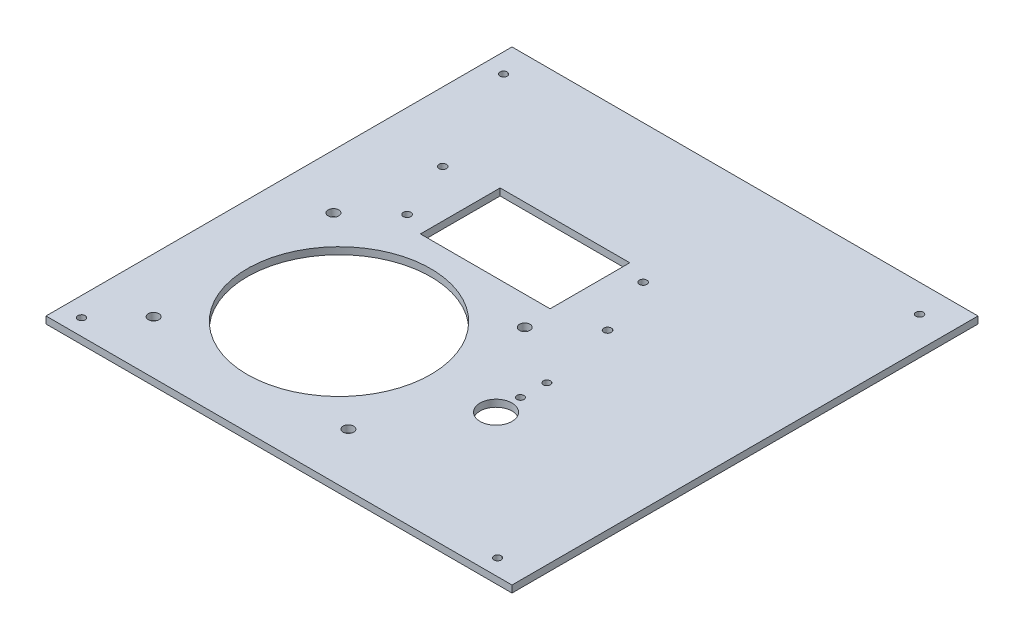
from build123d import *

# Parameters (mm, degrees)
SKETCH2_W           = 228.6
SKETCH2_H           = 228.6
BOSS_EXTRUDE2_DEPTH = 3.43
SKETCH3_R           = 45
CUT_EXTRUDE1_DEPTH  = 3.43
SKETCH4_R           = 2.6
CUT_EXTRUDE2_DEPTH  = 3.43
SKETCH4_3_R         = 2.6
CUT_EXTRUDE3_DEPTH  = 3.43
SKETCH4_4_R         = 2.6
CUT_EXTRUDE4_DEPTH  = 3.43
SKETCH13_W          = 63.6
SKETCH13_H          = 39.1
CUT_EXTRUDE6_DEPTH  = 10
SKETCH21_R          = 1.85
CUT_EXTRUDE11_DEPTH = 10
SKETCH16_R          = 1.8
CUT_EXTRUDE9_DEPTH  = 10
SKETCH17_R          = 1.73
SKETCH17_R_2        = 7.82641692
CUT_EXTRUDE10_DEPTH = 10


with BuildPart() as part:
    # Sketch2 → Boss-Extrude2 (new body)
    with BuildSketch(Plane(origin=(0, 0, 0), x_dir=(1, 0, 0), z_dir=(0, 1, 0))):
        Rectangle(SKETCH2_W, SKETCH2_H)
    extrude(amount=BOSS_EXTRUDE2_DEPTH)

    # Sketch3 → Cut-Extrude1 (cut)
    with BuildSketch(Plane(origin=(0, 3.43, 0), x_dir=(1, 0, 0), z_dir=(0, 1, 0))):
        with Locations((-40.039608825, -44.823101489)):
            Circle(SKETCH3_R)
    extrude(amount=-CUT_EXTRUDE1_DEPTH, mode=Mode.SUBTRACT)

    # Sketch4 → Cut-Extrude2 (cut)
    with BuildSketch(Plane(origin=(0, 3.43, 0), x_dir=(1, 0, 0), z_dir=(0, 1, 0))):
        with Locations((7.942522776, -1.692270962)):
            Circle(SKETCH4_R)
    extrude(amount=-CUT_EXTRUDE2_DEPTH, mode=Mode.SUBTRACT)

    # Sketch4<3> → Cut-Extrude3 (cut)
    with BuildSketch(Plane(origin=(0, 3.43, 0), x_dir=(1, 0, 0), z_dir=(0, 1, 0))):
        with Locations((-87.581844281, 0)):
            Circle(SKETCH4_3_R)
    extrude(amount=-CUT_EXTRUDE3_DEPTH, mode=Mode.SUBTRACT)

    # Sketch4<4> → Cut-Extrude4 (cut)
    with BuildSketch(Plane(origin=(0, 3.43, 0), x_dir=(1, 0, 0), z_dir=(0, 1, 0))):
        with Locations((7.942522776, -88.202101991)):
            Circle(SKETCH4_4_R)
        with Locations((-87.581844281, -88.202101991)):
            Circle(SKETCH4_4_R)
    extrude(amount=-CUT_EXTRUDE4_DEPTH, mode=Mode.SUBTRACT)

    # Sketch13 → Cut-Extrude6 (cut)
    with BuildSketch(Plane(origin=(0, 3.43, 0), x_dir=(1, 0, 0), z_dir=(0, 1, 0))):
        with Locations((-25.511426019, 31.937893032)):
            Rectangle(SKETCH13_W, SKETCH13_H)
    extrude(amount=-CUT_EXTRUDE6_DEPTH, mode=Mode.SUBTRACT)

    # Sketch21 → Cut-Extrude11 (cut)
    with BuildSketch(Plane(origin=(0, 3.43, 0), x_dir=(1, 0, 0), z_dir=(0, 1, 0))):
        with Locations((-80.511426019, 46.487893032)):
            Circle(SKETCH21_R)
        with Locations((-68.861426019, 17.387893032)):
            Circle(SKETCH21_R)
        with Locations((29.488573981, 17.387893032)):
            Circle(SKETCH21_R)
        with Locations((17.838573981, 46.487893032)):
            Circle(SKETCH21_R)
    extrude(amount=-CUT_EXTRUDE11_DEPTH, mode=Mode.SUBTRACT)

    # Sketch16 → Cut-Extrude9 (cut)
    with BuildSketch(Plane(origin=(0, 3.43, 0), x_dir=(1, 0, 0), z_dir=(0, 1, 0))):
        with Locations((99.249935188, -106.326440771)):
            Circle(SKETCH16_R)
        with Locations((99.249935188, 100.705817131)):
            Circle(SKETCH16_R)
        with Locations((-104.840818846, 100.705817131)):
            Circle(SKETCH16_R)
        with Locations((-104.840818846, -106.326440771)):
            Circle(SKETCH16_R)
    extrude(amount=-CUT_EXTRUDE9_DEPTH, mode=Mode.SUBTRACT)

    # Sketch17 → Cut-Extrude10 (cut)
    with BuildSketch(Plane(origin=(0, 3.43, 0), x_dir=(1, 0, 0), z_dir=(0, 1, 0))):
        with Locations((36.96258804, -19.846493577)):
            Circle(SKETCH17_R)
        with Locations((36.676933631, -32.543280633)):
            Circle(SKETCH17_R)
        with Locations((36.963684366, -44.799926749)):
            Circle(SKETCH17_R_2)
    extrude(amount=-CUT_EXTRUDE10_DEPTH, mode=Mode.SUBTRACT)


solid = part.part
